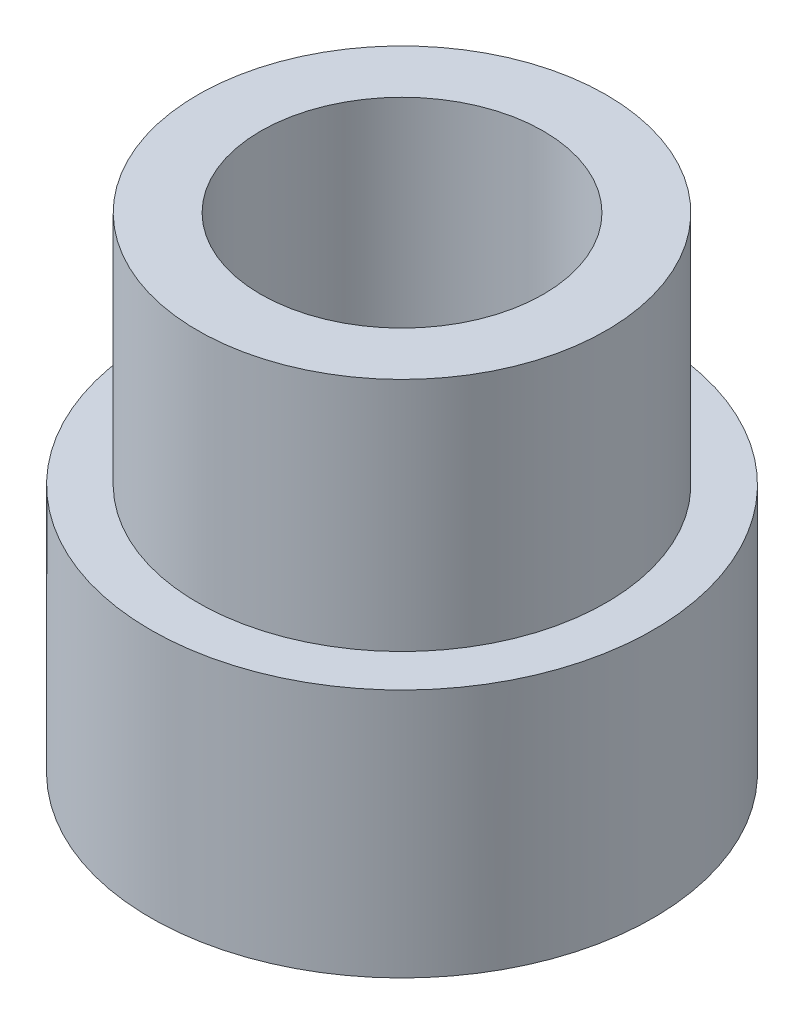
from build123d import *

# Parameters (mm, degrees)
SKETCH1_R           = 20.32
SKETCH1_R_2         = 4.6355
BOSS_EXTRUDE1_DEPTH = 10
SKETCH2_R           = 16.51
SKETCH2_R_2         = 11.43
BOSS_EXTRUDE2_DEPTH = 19.05
BOSS_EXTRUDE3_START = 10.16
SKETCH3_R           = 20.32
SKETCH3_R_2         = 4.6355
BOSS_EXTRUDE3_DEPTH = 10.16
CUT_EXTRUDE1_START  = -12
SKETCH4_R           = 11.43
CUT_EXTRUDE1_DEPTH  = 12
SKETCH5_R           = 8.5
CUT_EXTRUDE2_DEPTH  = 1.5


with BuildPart() as part:
    # Sketch1 → Boss-Extrude1 (new body)
    with BuildSketch(Plane(origin=(0, 0, 0), x_dir=(1, 0, 0), z_dir=(0, 1, 0))):
        with Locations(Location((0, 0, 0), (0, 0, 270))):
            Circle(SKETCH1_R)
        with Locations(Location((0, 0, 0), (0, 0, 270))):
            Circle(SKETCH1_R_2, mode=Mode.SUBTRACT)
    extrude(amount=BOSS_EXTRUDE1_DEPTH)

    # Sketch2 → Boss-Extrude2 (add)
    with BuildSketch(Plane(origin=(0, 10, 0), x_dir=(1, 0, 0), z_dir=(0, 1, 0))):
        with Locations(Location((0, 0, 0), (0, 0, 90))):
            Circle(SKETCH2_R)
        with Locations(Location((0, 0, 0), (0, 0, 90))):
            Circle(SKETCH2_R_2, mode=Mode.SUBTRACT)
    extrude(amount=BOSS_EXTRUDE2_DEPTH)

    # Sketch3 → Boss-Extrude3 (add)
    with BuildSketch(Plane(origin=(0, 0, 0), x_dir=(-1, 0, 0), z_dir=(0, -1, 0)).offset(BOSS_EXTRUDE3_START)):
        with Locations(Location((0, 0, 0), (0, 0, 90))):
            Circle(SKETCH3_R)
        with Locations(Location((0, 0, 0), (0, 0, 90))):
            Circle(SKETCH3_R_2, mode=Mode.SUBTRACT)
    extrude(amount=-BOSS_EXTRUDE3_DEPTH)

    # Sketch4 → Cut-Extrude1 (cut)
    with BuildSketch(Plane(origin=(0, 10, 0), x_dir=(1, 0, 0), z_dir=(0, 1, 0)).offset(CUT_EXTRUDE1_START)):
        with Locations(Location((0, 0, 0), (0, 0, 90))):
            Circle(SKETCH4_R)
    extrude(amount=CUT_EXTRUDE1_DEPTH, mode=Mode.SUBTRACT)

    # Sketch5 → Cut-Extrude2 (cut)
    with BuildSketch(Plane(origin=(0, -2, 0), x_dir=(1, 0, 0), z_dir=(0, 1, 0))):
        with Locations(Location((0, 0, 0), (0, 0, 270))):
            Circle(SKETCH5_R)
    extrude(amount=-CUT_EXTRUDE2_DEPTH, mode=Mode.SUBTRACT)


solid = part.part
